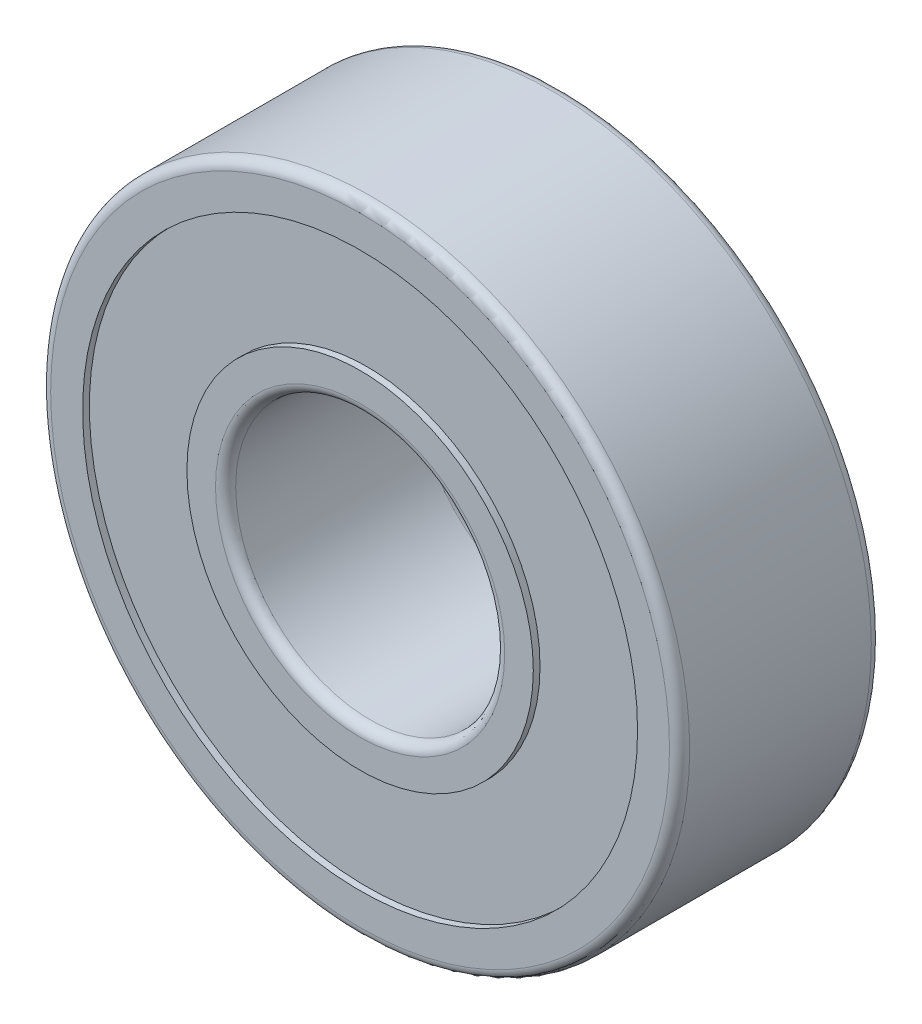
from build123d import *

# Parameters (mm, degrees)
SKETCH_1_R          = 9.5
SKETCH_1_R_2        = 4
EXTRUDE_1_DEPTH     = 3
SKETCH_2_R          = 8.25
SKETCH_2_R_2        = 5.15
CUT_EXTRUDE_2_DEPTH = 0.2
FILLET_1_R          = 0.3


with BuildPart() as part:
    # 草图1 → 拉伸1 (new, symmetric)
    with BuildSketch(Plane.XY):
        Circle(SKETCH_1_R)
        Circle(SKETCH_1_R_2, mode=Mode.SUBTRACT)
    extrude(amount=EXTRUDE_1_DEPTH, both=True)

    # 草图2 → 拉伸2 (cut)
    with BuildSketch(Plane.XY.offset(3)):
        Circle(SKETCH_2_R)
        Circle(SKETCH_2_R_2, mode=Mode.SUBTRACT)
    cut_extrude_2 = extrude(amount=-CUT_EXTRUDE_2_DEPTH, mode=Mode.SUBTRACT)

    # 镜向1: 拉伸2 across plane
    add(cut_extrude_2.mirror(Plane.XY), mode=Mode.SUBTRACT)

    # 圆角1
    fillet_1_edges = [part.edges().sort_by_distance(p)[0] for p in [
        (-9.5, 0, -3),
        (-9.5, 0, 3),
        (-4, 0, -3),
        (-4, 0, 3),
    ]]
    fillet(fillet_1_edges, radius=FILLET_1_R)


solid = part.part
